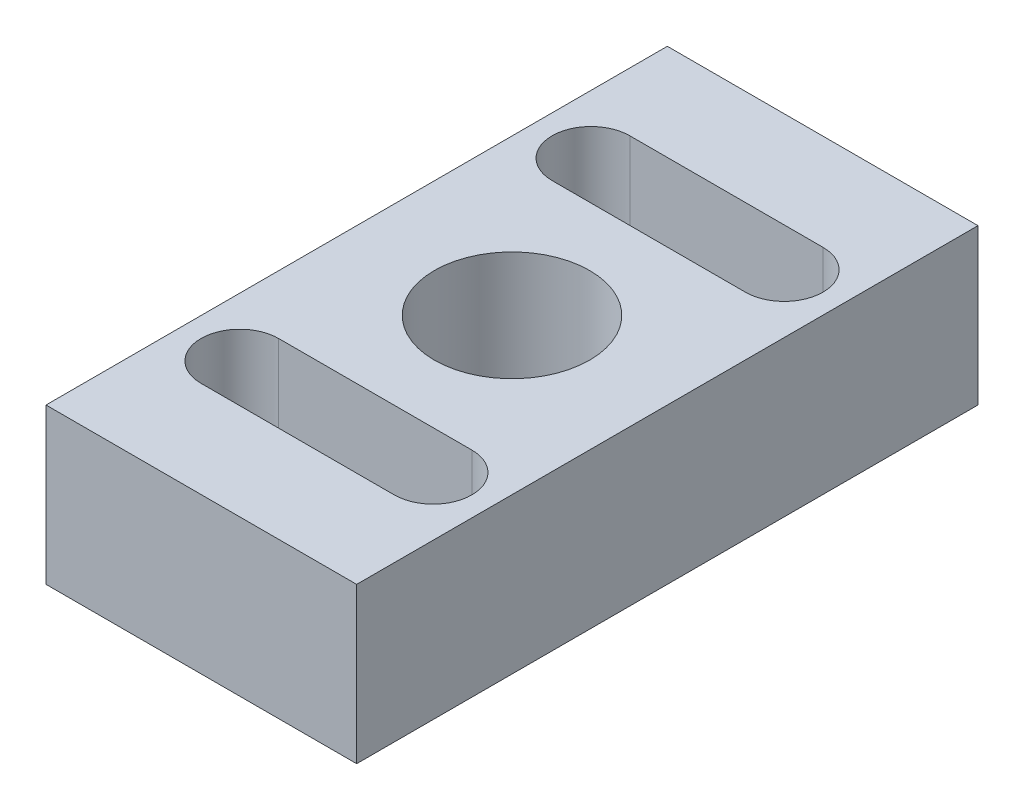
from build123d import *

# Parameters (mm, degrees)
SKETCH1_W           = 12.7
SKETCH1_H           = 25.4
BOSS_EXTRUDE1_DEPTH = 6.35
SKETCH2_R           = 3.175
CUT_EXTRUDE1_DEPTH  = 16.554259867
CUT_EXTRUDE2_DEPTH  = 16.554259867


with BuildPart() as part:
    # Sketch1 → Boss-Extrude1 (new body)
    with BuildSketch(Plane(origin=(0, 0, 0), x_dir=(1, 0, 0), z_dir=(0, 1, 0))):
        Rectangle(SKETCH1_W, SKETCH1_H)
    extrude(amount=BOSS_EXTRUDE1_DEPTH)

    # Sketch2 → Cut-Extrude1 (cut, through all)
    with BuildSketch(Plane(origin=(0, 6.35, 0), x_dir=(1, 0, 0), z_dir=(0, 1, 0))):
        with Locations(Location((0, 0, 0), (0, 0, 270))):
            Circle(SKETCH2_R)
    extrude(amount=-CUT_EXTRUDE1_DEPTH, mode=Mode.SUBTRACT)

    # Sketch3 → Cut-Extrude2 (cut, through all)
    with BuildSketch(Plane(origin=(0, 6.35, 0), x_dir=(1, 0, 0), z_dir=(0, 1, 0))):
        with BuildLine():
            Line((-3.949618405, 8.764602641), (3.949618405, 8.764602641))
            ThreePointArc((3.949618405, 8.764602641), (5.537118405, 7.177102641), (3.949618405, 5.589602641))
            Line((3.949618405, 5.589602641), (-3.949618405, 5.589602641))
            ThreePointArc((-3.949618405, 5.589602641), (-5.537118405, 7.177102641), (-3.949618405, 8.764602641))
        make_face()
    cut_extrude2 = extrude(amount=-CUT_EXTRUDE2_DEPTH, mode=Mode.SUBTRACT)

    # Mirror1: Cut-Extrude2 across plane
    add(cut_extrude2.mirror(Plane.XY), mode=Mode.SUBTRACT)


solid = part.part
